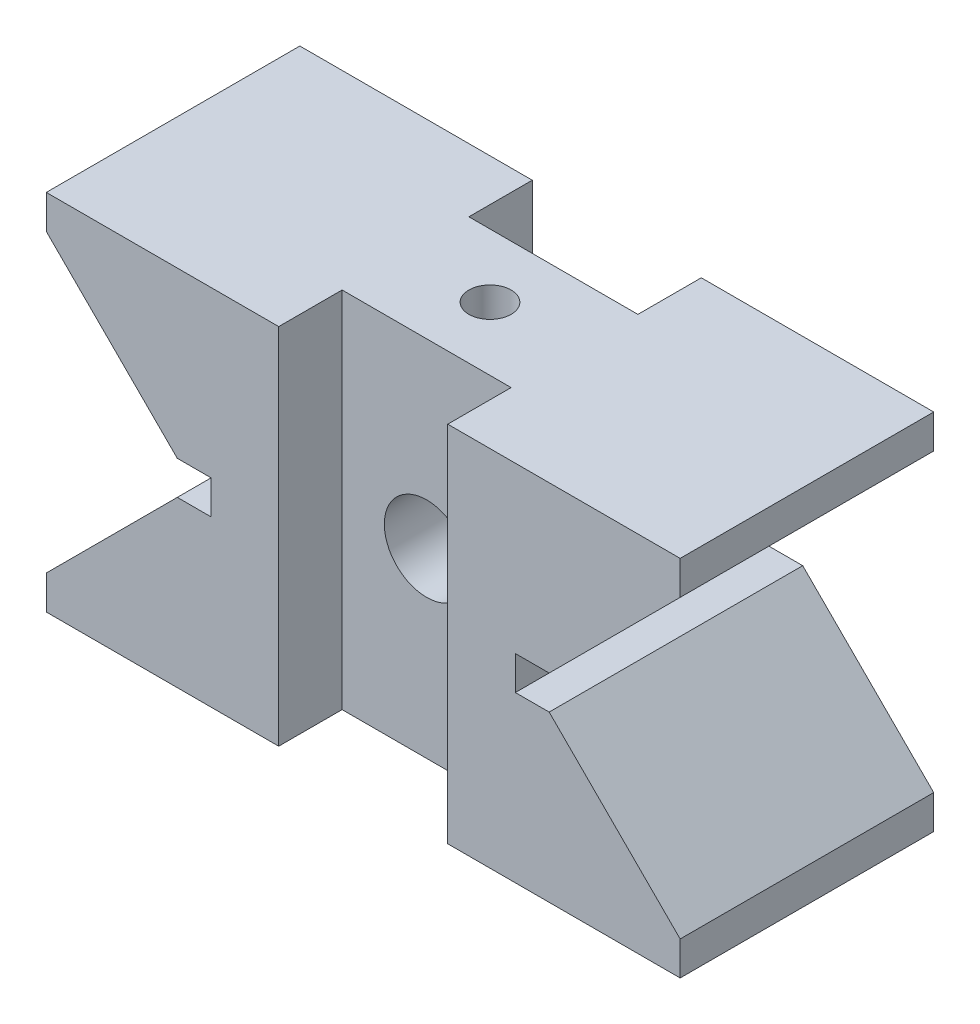
from build123d import *

# Parameters (mm, degrees)
BOSS_EXTRU_1_DEPTH      = 60
ESQUISSE2_W             = 40
ESQUISSE2_H             = 86
ENL_V_MAT_EXTRU_1_DEPTH = 15
ESQUISSE3_W             = 40
ESQUISSE3_H             = 86
ENL_V_MAT_EXTRU_2_DEPTH = 15
ESQUISSE4_R             = 10
ENL_V_MAT_EXTRU_3_DEPTH = 98.462813421
ESQUISSE5_R             = 5
ENL_V_MAT_EXTRU_4_DEPTH = 129.922457314


with BuildPart() as part:
    # Esquisse1 → Boss.-Extru.1 (new body)
    with BuildSketch(Plane.XY):
        Polygon((-75, 43), (75, 43), (75, 35), (44, 4), (36, 4), (36, -4), (44, -4), (75, -35), (75, -43), (-75, -43), (-75, -35), (-44, -4), (-36, -4), (-36, 4), (-44, 4), (-75, 35), align=None)
    extrude(amount=BOSS_EXTRU_1_DEPTH)

    # Esquisse2 → Enlèv. mat.-Extru.1 (cut)
    with BuildSketch(Plane.XY.offset(60)):
        Rectangle(ESQUISSE2_W, ESQUISSE2_H)
    extrude(amount=-ENL_V_MAT_EXTRU_1_DEPTH, mode=Mode.SUBTRACT)

    # Esquisse3 → Enlèv. mat.-Extru.2 (cut)
    with BuildSketch(Plane(origin=(0, 0, 0), x_dir=(-1, 0, 0), z_dir=(0, 0, -1))):
        Rectangle(ESQUISSE3_W, ESQUISSE3_H)
    extrude(amount=-ENL_V_MAT_EXTRU_2_DEPTH, mode=Mode.SUBTRACT)

    # Esquisse4 → Enlèv. mat.-Extru.3 (cut, through all)
    with BuildSketch(Plane(origin=(0, 0, 15), x_dir=(-1, 0, 0), z_dir=(0, 0, -1))):
        Circle(ESQUISSE4_R)
    extrude(amount=-ENL_V_MAT_EXTRU_3_DEPTH, mode=Mode.SUBTRACT)

    # Esquisse5 → Enlèv. mat.-Extru.4 (cut, through all)
    with BuildSketch(Plane(origin=(0, 43, 0), x_dir=(1, 0, 0), z_dir=(0, 1, 0))):
        with Locations(Location((0, -30, 0), (0, 0, 270))):
            Circle(ESQUISSE5_R)
    extrude(amount=-ENL_V_MAT_EXTRU_4_DEPTH, mode=Mode.SUBTRACT)


solid = part.part
